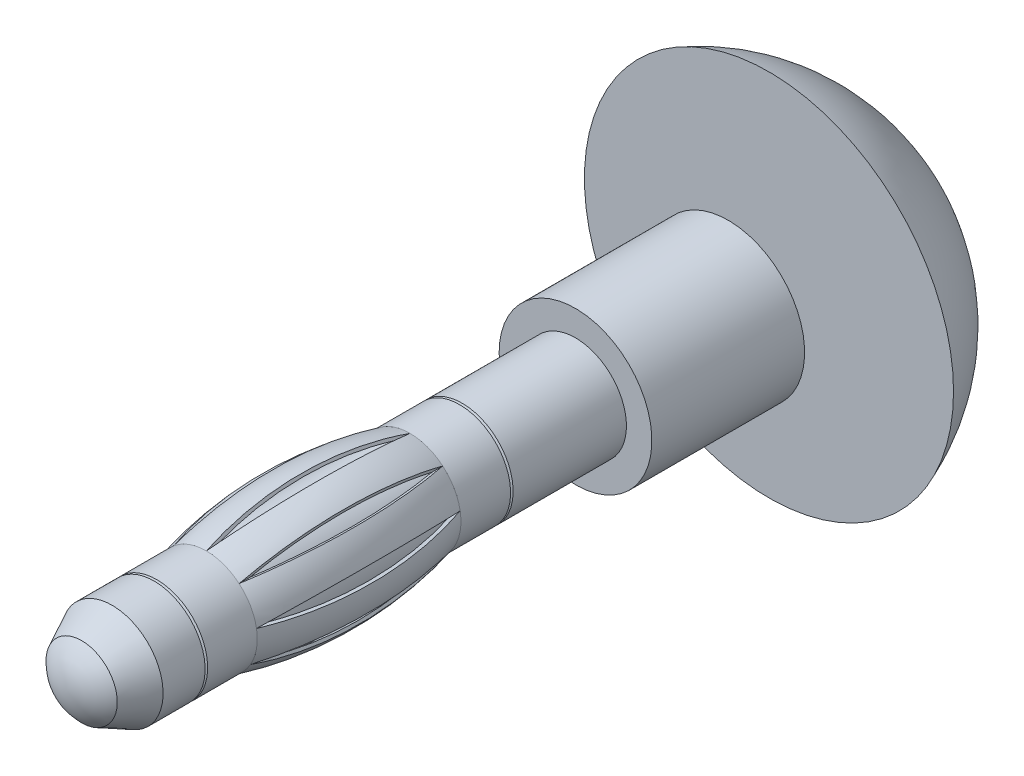
from build123d import *

# Parameters (mm, degrees)
ENL_V_START             = 6
ENL_V_MAT_EXTRU_2_DEPTH = 21.343879745


with BuildPart() as part:
    # Esquisse1 → base (revolve)
    with BuildSketch(Plane(origin=(0, 0, 0), x_dir=(0, 0, -1), z_dir=(1, 0, 0)), mode=Mode.PRIVATE) as base_sk:
        with BuildLine():
            Line((0, 1.55), (0, 3))
            Line((0, 3), (-6, 3))
            Line((-6, 3), (-6, 2))
            Line((-6, 2), (-10.45, 2))
            Line((-10.45, 2), (-10.5, 1.9))
            Line((-10.5, 1.9), (-10.55, 2))
            Line((-10.55, 2), (-12.5, 2))
            ThreePointArc((-12.5, 2), (-16.5, 2.5), (-20.5, 2))
            Line((-20.5, 2), (-22.45, 2))
            Line((-22.45, 2), (-22.5, 1.9))
            Line((-22.5, 1.9), (-22.55, 2))
            Line((-22.55, 2), (-24.2, 2))
            Line((-24.2, 2), (-25.4, 1.4))
            ThreePointArc((-25.4, 1.4), (-25.843680391, 0.761577311), (-26, 0))
            Line((-26, 0), (-7, 0))
            Line((-7, 0), (-7, 0.95))
            Line((-7, 0.95), (-6.7, 1.25))
            Line((-6.7, 1.25), (-0.3, 1.25))
            Line((-0.3, 1.25), (0, 1.55))
        make_face()
        with BuildLine():
            Line((-12.92788578, 2), (-12.92788578, 1.9))
            Line((-12.92788578, 1.9), (-20.07211422, 1.9))
            Line((-20.07211422, 1.9), (-20.07211422, 2))
            ThreePointArc((-20.07211422, 2), (-16.5, 2.4), (-12.92788578, 2))
        make_face(mode=Mode.SUBTRACT)
    revolve(base_sk.sketch.rotate(Axis((0, 0, 0), (0, 0, 1)), 90), axis=Axis((0, 0, 0), (0, 0, 1)))

    # Esquisse2 → Enlèv. mat.-Extru.2 (cut, through all)
    with BuildSketch(Plane.XY.offset(ENL_V_START)):
        Polygon((0.3, 2.5), (-0.3, 2.5), (0, 2), align=None)
        Polygon((1.836782357, 1.722274825), (1.285575219, 1.532088886), (1.377155691, 2.107947391), align=None)
        Polygon((2.514113836, 0.138678118), (1.969615506, 0.347296355), (2.409924929, 0.72956277), align=None)
        Polygon((2.015063509, -1.509807621), (1.732050808, -1), (2.315063509, -0.990192379), align=None)
        Polygon((0.573142572, -2.451837595), (0.684040287, -1.879385242), (1.136958145, -2.246625509), align=None)
        Polygon((-1.136958145, -2.246625509), (-0.684040287, -1.879385242), (-0.573142572, -2.451837595), align=None)
        Polygon((-2.315063509, -0.990192379), (-1.732050808, -1), (-2.015063509, -1.509807621), align=None)
        Polygon((-2.409924929, 0.72956277), (-1.969615506, 0.347296355), (-2.514113836, 0.138678118), align=None)
        Polygon((-1.377155691, 2.107947391), (-1.285575219, 1.532088886), (-1.836782357, 1.722274825), align=None)
    extrude(amount=ENL_V_MAT_EXTRU_2_DEPTH, mode=Mode.SUBTRACT)


with BuildPart() as body_2:
    # Esquisse3 → Révolution1 (revolve)
    with BuildSketch(Plane(origin=(0, 0, 0), x_dir=(1, 0, 0), z_dir=(0, 1, 0))):
        with BuildLine():
            Line((7.25, 1.6), (0, 1.6))
            Line((0, 1.6), (0, 6.6))
            ThreePointArc((0, 6.6), (4.403478738, 5.228794171), (7.25, 1.6))
        make_face()
    revolve(axis=Axis((0, 0, 0), (0, 0, -1)))


solid = Compound([part.part, body_2.part])
